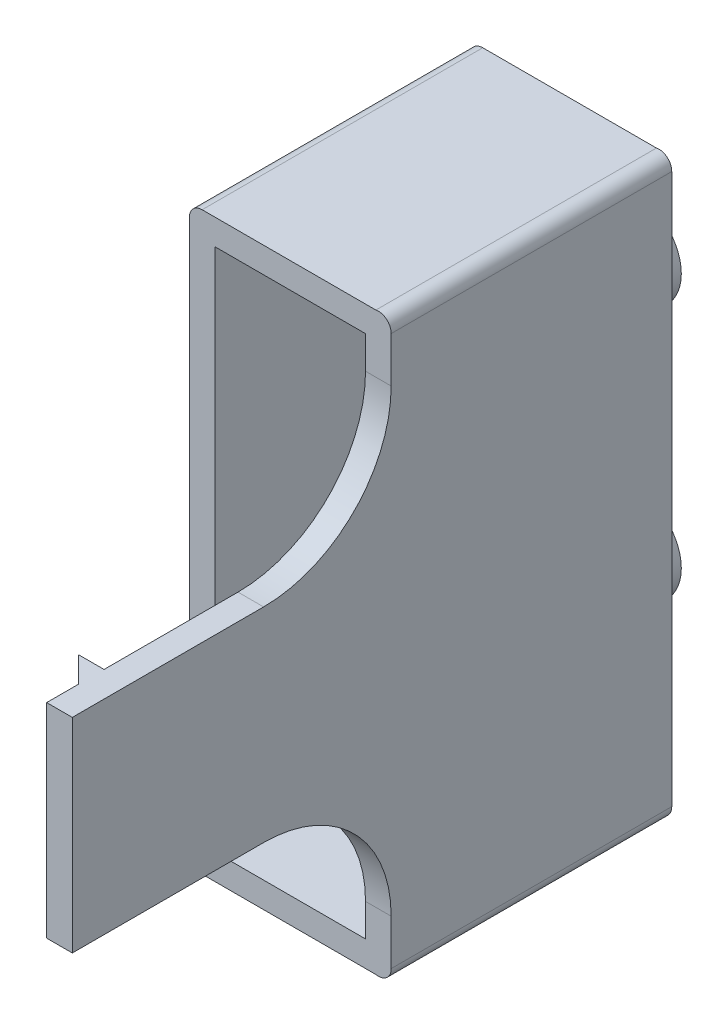
from build123d import *

# Parameters (mm, degrees)
SKETCH1_R             = 3.66
SKETCH1_R_2           = 1.65
BOSS_EXTRUDE1_DEPTH   = 5
BOSS_EXTRUDE1_2_DEPTH = 5
SKETCH2_R             = 1.65
BOSS_EXTRUDE2_DEPTH   = 22
SKETCH3_W             = 11.8
SKETCH3_H             = 41.1
CUT_EXTRUDE1_DEPTH    = 20
SKETCH4_W             = 2.01
SKETCH4_H             = 16
BOSS_EXTRUDE3_DEPTH   = 25
FILLET1_R             = 10
BOSS_EXTRUDE4_DEPTH   = 16


with BuildPart() as part:
    # Sketch1 → Boss-Extrude1 (new body)
    with BuildSketch(Plane.XY):
        with Locations((0, -9.999161717)):
            Circle(SKETCH1_R)
        with Locations((0, -9.999161717)):
            Circle(SKETCH1_R_2, mode=Mode.SUBTRACT)
    extrude(amount=BOSS_EXTRUDE1_DEPTH)



with BuildPart() as body_2:
    # Sketch1 → Boss-Extrude1 2 (new body)
    with BuildSketch(Plane.XY):
        with Locations((0, 9.999161717)):
            Circle(SKETCH1_R)
        with Locations((0, 9.999161717)):
            Circle(SKETCH1_R_2, mode=Mode.SUBTRACT)
    extrude(amount=BOSS_EXTRUDE1_2_DEPTH)


with BuildPart() as part_1:
    add(part.part)

    add(body_2.part)  # Boss-Extrude2 merges body 2
    # Sketch2 → Boss-Extrude2 (add)
    with BuildSketch(Plane.XY.offset(5)):
        with BuildLine():
            Line((-6.91, 22.56), (6.71, 22.56))
            ThreePointArc((6.71, 22.56), (7.550387634, 22.348468599), (7.91, 21.560004361))
            Line((7.91, 21.560004361), (7.91, -21.560004361))
            ThreePointArc((7.91, -21.560004361), (7.550387634, -22.348468599), (6.71, -22.56))
            Line((6.71, -22.56), (-6.91, -22.56))
            ThreePointArc((-6.91, -22.56), (-7.617106781, -22.267106781), (-7.91, -21.56))
            Line((-7.91, -21.56), (-7.91, 21.56))
            ThreePointArc((-7.91, 21.56), (-7.617106781, 22.267106781), (-6.91, 22.56))
        make_face()
        with Locations((0, 9.999161717)):
            Circle(SKETCH2_R, mode=Mode.SUBTRACT)
        with Locations((0, -9.999161717)):
            Circle(SKETCH2_R, mode=Mode.SUBTRACT)
    extrude(amount=BOSS_EXTRUDE2_DEPTH)

    # Sketch3 → Cut-Extrude1 (cut)
    with BuildSketch(Plane.XY.offset(27)):
        Rectangle(SKETCH3_W, SKETCH3_H)
    extrude(amount=-CUT_EXTRUDE1_DEPTH, mode=Mode.SUBTRACT)

    # Sketch4 → Boss-Extrude3 (add)
    with BuildSketch(Plane.XY.offset(27)):
        with Locations((6.905, 0)):
            Rectangle(SKETCH4_W, SKETCH4_H)
    extrude(amount=BOSS_EXTRUDE3_DEPTH)

    # Fillet1
    fillet1_edges = [part_1.edges().sort_by_distance(p)[0] for p in [
        (6.905, -8, 27),
        (6.905, 8, 27),
    ]]
    fillet(fillet1_edges, radius=FILLET1_R)

    # Sketch5 → Boss-Extrude4 (add)
    with BuildSketch(Plane.XZ.offset(8)):
        Polygon((5.9, 47.5), (3.9, 47.5), (5.9, 49.5), align=None)
    extrude(amount=-BOSS_EXTRUDE4_DEPTH)


solid = part_1.part
